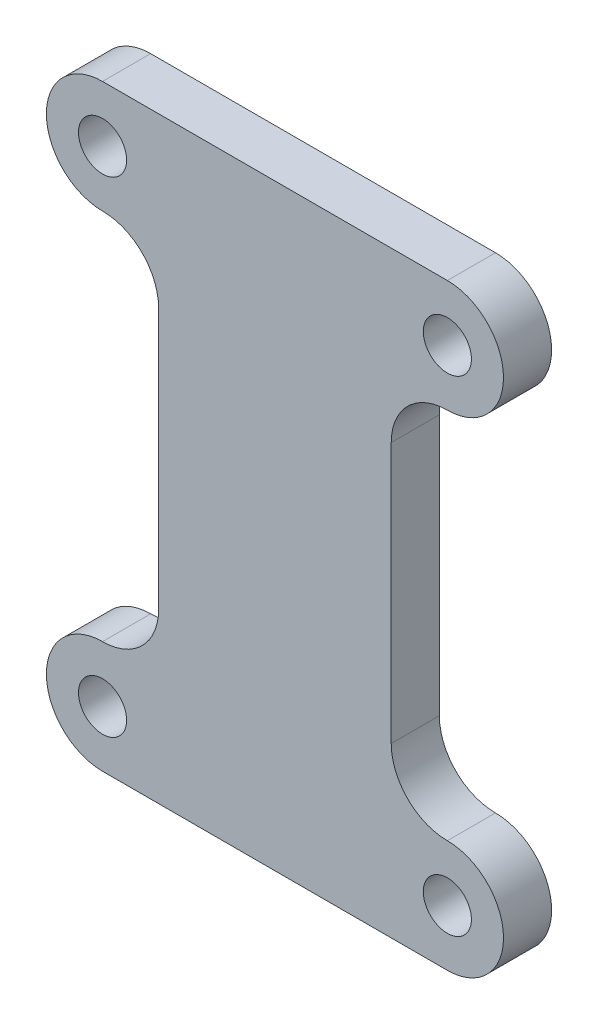
from build123d import *

# Parameters (mm, degrees)
SKETCH1_R           = 1.5
BOSS_EXTRUDE1_DEPTH = 1.5


with BuildPart() as part:
    # Sketch1 → Boss-Extrude1 (new, symmetric)
    with BuildSketch(Plane.XY):
        with BuildLine():
            Line((-10.75, 18.625), (10.75, 18.625))
            ThreePointArc((10.75, 18.625), (14.25, 15.125), (10.75, 11.625))
            ThreePointArc((10.75, 11.625), (8.275126266, 10.599873734), (7.25, 8.125))
            Line((7.25, 8.125), (7.25, -8.125))
            ThreePointArc((7.25, -8.125), (8.275126266, -10.599873734), (10.75, -11.625))
            ThreePointArc((10.75, -11.625), (14.25, -15.125), (10.75, -18.625))
            Line((10.75, -18.625), (-10.75, -18.625))
            ThreePointArc((-10.75, -18.625), (-14.25, -15.125), (-10.75, -11.625))
            ThreePointArc((-10.75, -11.625), (-8.275126266, -10.599873734), (-7.25, -8.125))
            Line((-7.25, -8.125), (-7.25, 8.125))
            ThreePointArc((-7.25, 8.125), (-8.275126266, 10.599873734), (-10.75, 11.625))
            ThreePointArc((-10.75, 11.625), (-14.25, 15.125), (-10.75, 18.625))
        make_face()
        with Locations((-10.75, 15.125)):
            Circle(SKETCH1_R, mode=Mode.SUBTRACT)
        with Locations((10.75, 15.125)):
            Circle(SKETCH1_R, mode=Mode.SUBTRACT)
        with Locations((10.75, -15.125)):
            Circle(SKETCH1_R, mode=Mode.SUBTRACT)
        with Locations((-10.75, -15.125)):
            Circle(SKETCH1_R, mode=Mode.SUBTRACT)
    extrude(amount=BOSS_EXTRUDE1_DEPTH, both=True)


solid = part.part
